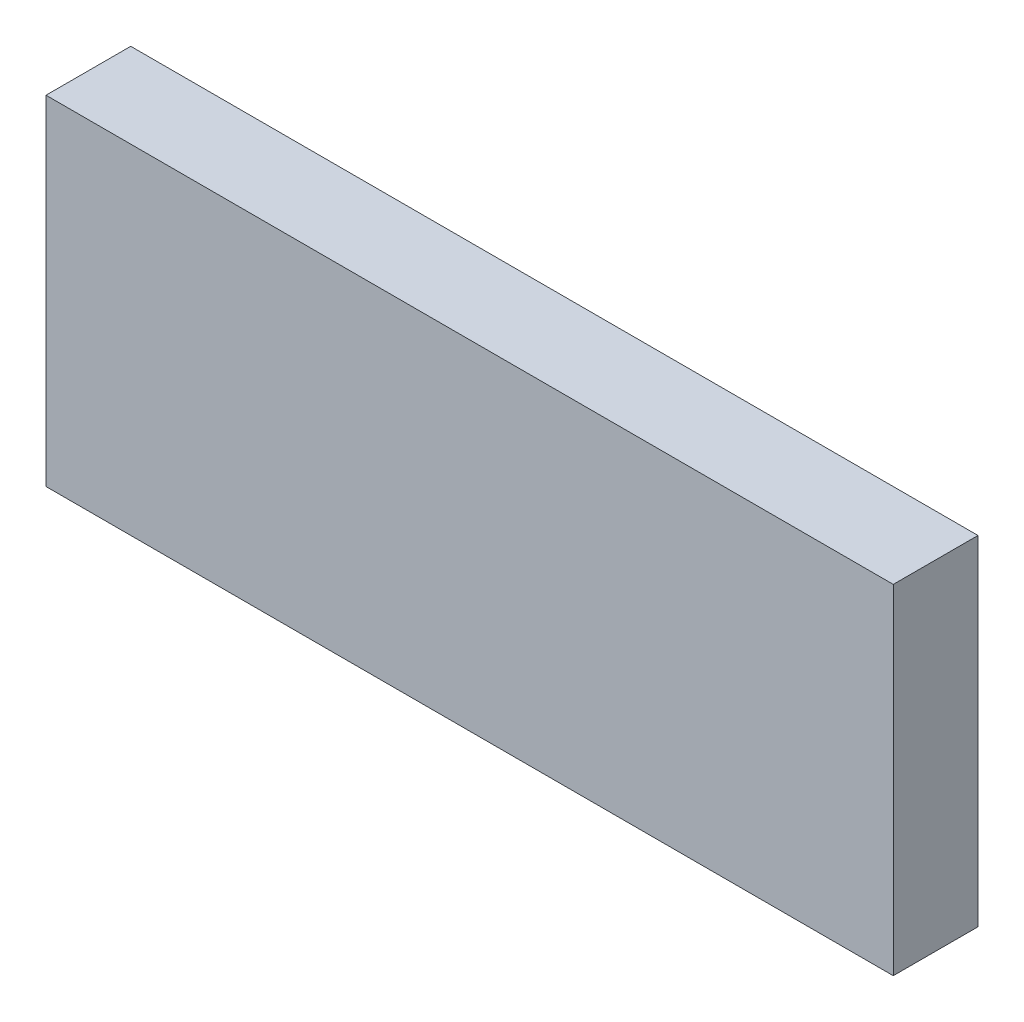
from build123d import *

# Parameters (mm, degrees)
SKETCH_1_W      = 100
SKETCH_1_H      = 40
EXTRUDE_1_DEPTH = 10


with BuildPart() as part:
    # 草图1 → 凸台-拉伸1 (new body)
    with BuildSketch(Plane.XY):
        Rectangle(SKETCH_1_W, SKETCH_1_H)
    extrude(amount=EXTRUDE_1_DEPTH)


solid = part.part
